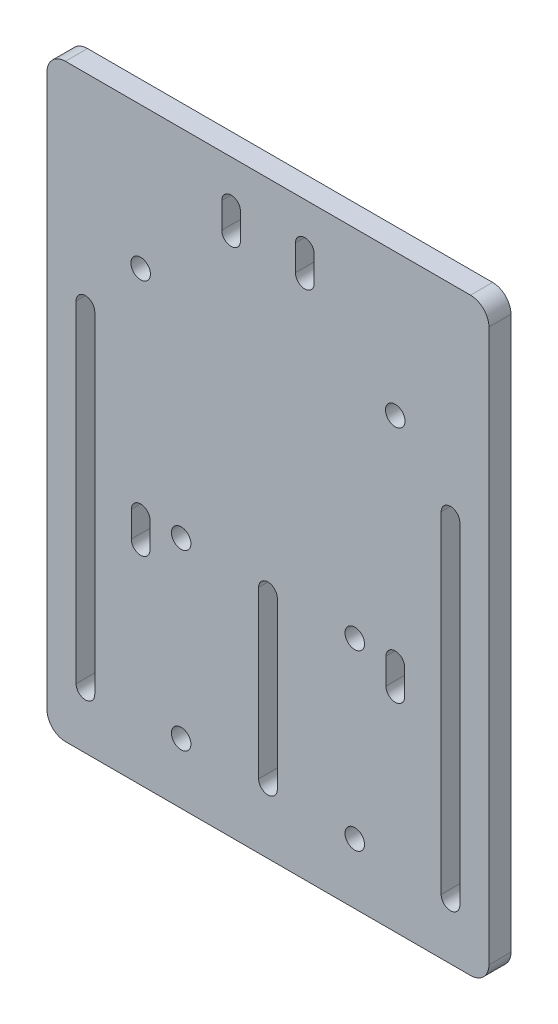
from build123d import *

# Parameters (mm, degrees)
BOSS_EXTRUDE1_DEPTH  = 6
CUT_EXTRUDE1_DEPTH   = 6
M5_CLEARANCE_HOLE1_D = 5.3
CUT_EXTRUDE2_DEPTH   = 22
M5_CLEARANCE_HOLE2_D = 5.3
CUT_EXTRUDE3_DEPTH   = 6
CUT_EXTRUDE4_DEPTH   = 6


with BuildPart() as part:
    # Sketch2 → Boss-Extrude1 (new body)
    with BuildSketch(Plane.XY):
        with BuildLine():
            Line((-55, -80), (55, -80))
            ThreePointArc((55, -80), (58.535533906, -78.535533906), (60, -75))
            Line((60, -75), (60, 75))
            ThreePointArc((60, 75), (58.535533906, 78.535533906), (55, 80))
            Line((55, 80), (-55, 80))
            ThreePointArc((-55, 80), (-58.535533906, 78.535533906), (-60, 75))
            Line((-60, 75), (-60, -75))
            ThreePointArc((-60, -75), (-58.535533906, -78.535533906), (-55, -80))
        make_face()
    extrude(amount=BOSS_EXTRUDE1_DEPTH)

    # Sketch3 → Cut-Extrude1 (cut)
    with BuildSketch(Plane.XY.offset(6)):
        with BuildLine():
            Line((2.54, -17.5), (2.54, -62.5))
            ThreePointArc((2.54, -62.5), (0, -65.04), (-2.54, -62.5))
            Line((-2.54, -62.5), (-2.54, -17.5))
            ThreePointArc((-2.54, -17.5), (0, -14.96), (2.54, -17.5))
        make_face()
    extrude(amount=-CUT_EXTRUDE1_DEPTH, mode=Mode.SUBTRACT)

    # M5 Clearance Hole1 (through all)
    with Locations(Plane.XY.offset(6)):
        with Locations((-23.57, -63.57), (-23.57, -16.43), (23.57, -16.43), (23.57, -63.57)):
            Hole(M5_CLEARANCE_HOLE1_D / 2)

    # Sketch6 → Cut-Extrude2 (cut)
    with BuildSketch(Plane.XY.offset(6)):
        with BuildLine():
            Line((-32.03, -16.43), (-32.03, -23.43))
            ThreePointArc((-32.03, -23.43), (-34.57, -25.97), (-37.11, -23.43))
            Line((-37.11, -23.43), (-37.11, -16.43))
            ThreePointArc((-37.11, -16.43), (-34.57, -13.89), (-32.03, -16.43))
        make_face()
    cut_extrude2 = extrude(amount=-CUT_EXTRUDE2_DEPTH, mode=Mode.SUBTRACT)

    # M5 Clearance Hole2 (through all)
    with Locations(Plane.XY.offset(6)):
        with Locations((-34.57, 41.47)):
            m5_clearance_hole2 = Hole(M5_CLEARANCE_HOLE2_D / 2)

    # Sketch9 → Cut-Extrude3 (cut)
    with BuildSketch(Plane.XY.offset(6)):
        with BuildLine():
            Line((-47.03, 25.07), (-47.03, -64.93))
            ThreePointArc((-47.03, -64.93), (-49.57, -67.47), (-52.11, -64.93))
            Line((-52.11, -64.93), (-52.11, 25.07))
            ThreePointArc((-52.11, 25.07), (-49.57, 27.61), (-47.03, 25.07))
        make_face()
    cut_extrude3 = extrude(amount=-CUT_EXTRUDE3_DEPTH, mode=Mode.SUBTRACT)

    # Mirror2: Cut-Extrude2, M5 Clearance Hole2, Cut-Extrude3 across plane
    add(cut_extrude2.mirror(Plane(origin=(0, 0, 0), x_dir=(0, 0, 1), z_dir=(1, 0, 0))), mode=Mode.SUBTRACT)
    add(m5_clearance_hole2.mirror(Plane(origin=(0, 0, 0), x_dir=(0, 0, 1), z_dir=(1, 0, 0))), mode=Mode.SUBTRACT)
    add(cut_extrude3.mirror(Plane(origin=(0, 0, 0), x_dir=(0, 0, 1), z_dir=(1, 0, 0))), mode=Mode.SUBTRACT)

    # Sketch11 → Cut-Extrude4 (cut)
    with BuildSketch(Plane.XY.offset(6)):
        with BuildLine():
            Line((-7.46, 68.5), (-7.46, 61.5))
            ThreePointArc((-7.46, 61.5), (-10, 58.96), (-12.54, 61.5))
            Line((-12.54, 61.5), (-12.54, 68.5))
            ThreePointArc((-12.54, 68.5), (-10, 71.04), (-7.46, 68.5))
        make_face()
        with BuildLine():
            Line((12.54, 68.5), (12.54, 61.5))
            ThreePointArc((12.54, 61.5), (10, 58.96), (7.46, 61.5))
            Line((7.46, 61.5), (7.46, 68.5))
            ThreePointArc((7.46, 68.5), (10, 71.04), (12.54, 68.5))
        make_face()
    extrude(amount=-CUT_EXTRUDE4_DEPTH, mode=Mode.SUBTRACT)


solid = part.part
